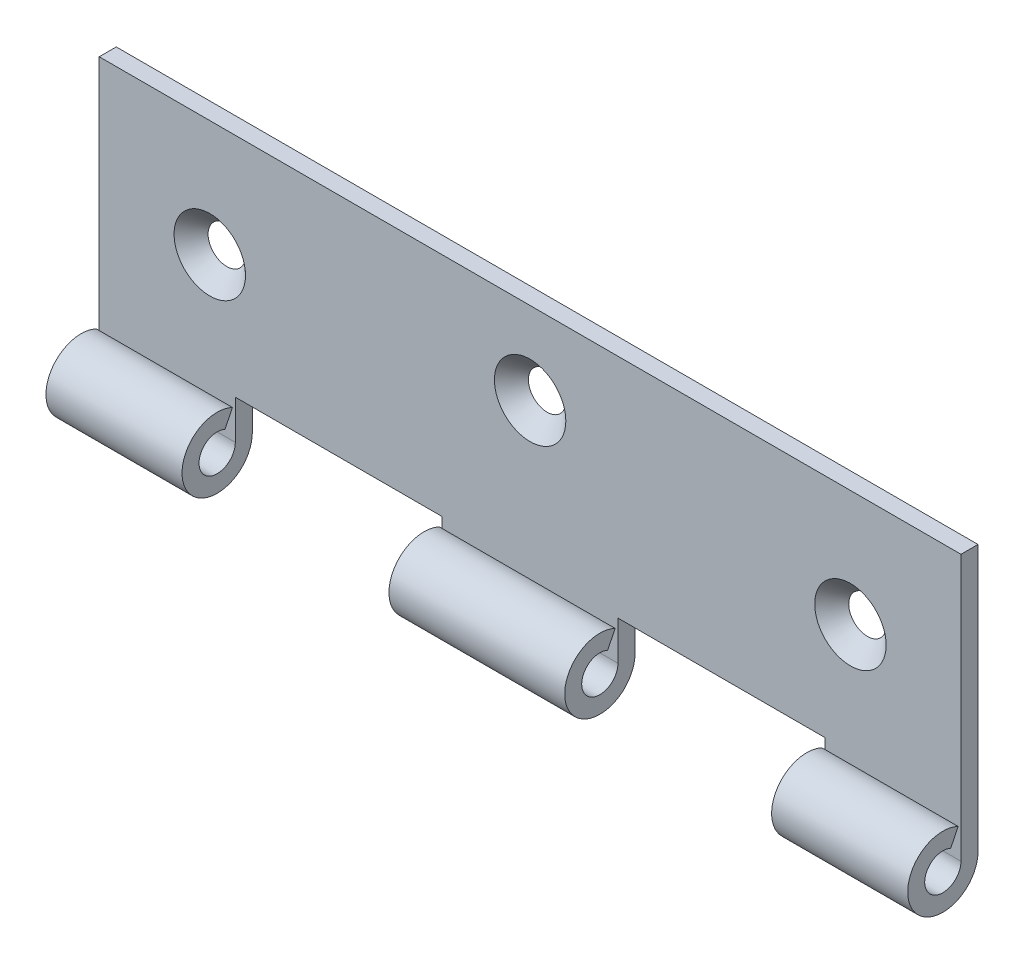
from build123d import *

# Parameters (mm, degrees)
SKETCH1_W                                    = 76
SKETCH1_H                                    = 20
EXTRUDE1_DEPTH                               = 1.5
SKETCH3_W                                    = 15.5
SKETCH3_H                                    = 1.5
SKETCH4_W                                    = 12
SKETCH4_H                                    = 1.5
SKETCH2_W                                    = 12
SKETCH2_H                                    = 1.5
CSK_FOR_M3_COUNTERSUNK_FLAT_HEAD_SCR_2_COUNT = 2
CSK_FOR_M3_COUNTERSUNK_FLAT_HEAD_SCR_2_PITCH = 28.408845453
CSK_FOR_M3_COUNTERSUNK_FLAT_HEAD_SCR_3_COUNT = 2
CSK_FOR_M3_COUNTERSUNK_FLAT_HEAD_SCR_3_PITCH = 56.5


with BuildPart() as part:
    # Sketch1 → Extrude1 (new body)
    with BuildSketch(Plane.XY):
        Rectangle(SKETCH1_W, SKETCH1_H)
    extrude(amount=EXTRUDE1_DEPTH)

    # Sweep1: sweep along a path in Sketch5
    with BuildLine(Plane(origin=(0, 0, 0), x_dir=(0, 0, -1), z_dir=(1, 0, 0))) as sweep1_path:
        Line((-0.75, -10), (-0.75, -13.45))
        ThreePointArc((-0.75, -13.45), (-5.089163608, -14.70129059), (-2.082534588, -11.331683655))
    # Sketch3 → Sweep1 (sweep)
    with BuildSketch(Plane.XZ.offset(10)):
        with Locations((0, 0.75)):
            Rectangle(SKETCH3_W, SKETCH3_H)
    sweep(path=sweep1_path.line)

    # Sweep2: sweep along a path in Sketch7
    with BuildLine(Plane(origin=(32, 0, 0), x_dir=(0, 0, -1), z_dir=(1, 0, 0))) as sweep2_path:
        Line((-0.75, -10), (-0.75, -13.45))
        ThreePointArc((-0.75, -13.45), (-5.089163608, -14.70129059), (-2.082534588, -11.331683655))
    # Sketch4 → Sweep2 (sweep)
    with BuildSketch(Plane.XZ.offset(10)):
        with Locations((32, 0.75)):
            Rectangle(SKETCH4_W, SKETCH4_H)
    sweep(path=sweep2_path.line)

    # Sweep3: sweep along a path in Sketch6
    with BuildLine(Plane(origin=(-32, 0, 0), x_dir=(0, 0, -1), z_dir=(1, 0, 0))) as sweep3_path:
        Line((-0.75, -10), (-0.75, -13.45))
        ThreePointArc((-0.75, -13.45), (-5.089163608, -14.70129059), (-2.082534588, -11.331683655))
    # Sketch2 → Sweep3 (sweep)
    with BuildSketch(Plane.XZ.offset(10)):
        with Locations((-32, 0.75)):
            Rectangle(SKETCH2_W, SKETCH2_H)
    sweep(path=sweep3_path.line)

    # Sketch9 → CSK for M3 Countersunk Flat Head Screw1 (revolve, cut)
    with BuildSketch(Plane(origin=(28.25, -0.25, 1.5), x_dir=(0, -1, 0), z_dir=(1, 0, 0))):
        Polygon((0, 0), (0, 1.50005), (1.6, 1.50005), (1.6, 1.55), (3.15, 0), align=None)
    csk_for_m3_countersunk_flat_head_screw1 = revolve(axis=Axis((28.25, -0.25, 7.85), (0, 0, -1)), mode=Mode.SUBTRACT)

    # CSK for M3 Countersunk Flat Head Scr 2: CSK for M3 Countersunk Flat Head Screw1 ×2
    with Locations(*[Vector(-0.994408591727349, 0.10560091239582468, 0) * (i * CSK_FOR_M3_COUNTERSUNK_FLAT_HEAD_SCR_2_PITCH) for i in range(1, CSK_FOR_M3_COUNTERSUNK_FLAT_HEAD_SCR_2_COUNT)]):
        add(csk_for_m3_countersunk_flat_head_screw1, mode=Mode.SUBTRACT)

    # CSK for M3 Countersunk Flat Head Scr 3: CSK for M3 Countersunk Flat Head Screw1 ×2
    with Locations(*[(-i * CSK_FOR_M3_COUNTERSUNK_FLAT_HEAD_SCR_3_PITCH, 0, 0) for i in range(1, CSK_FOR_M3_COUNTERSUNK_FLAT_HEAD_SCR_3_COUNT)]):
        add(csk_for_m3_countersunk_flat_head_screw1, mode=Mode.SUBTRACT)


solid = part.part
